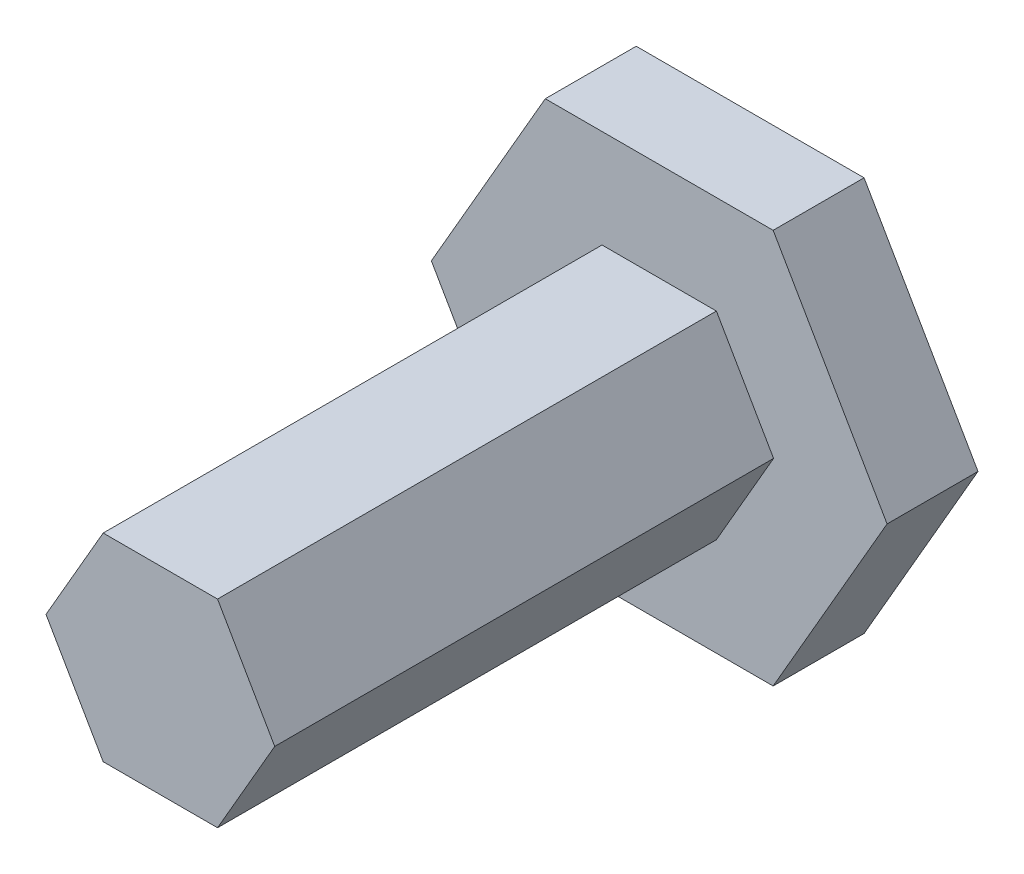
from build123d import *

# Parameters (mm, degrees)
BOSS_EXTRUDE1_DEPTH = 10
BOSS_EXTRUDE2_DEPTH = 2
MOVE_FACE1_BY       = 0.15
MOVE_FACE1_2_BY     = 0.15
MOVE_FACE1_3_BY     = 0.15
MOVE_FACE1_4_BY     = 0.15
MOVE_FACE1_5_BY     = 0.15
MOVE_FACE1_6_BY     = 0.15
MOVE_FACE1_7_BY     = 0.15
MOVE_FACE1_8_BY     = 0.15
MOVE_FACE1_9_BY     = 0.15
MOVE_FACE1_10_BY    = 0.15
MOVE_FACE1_11_BY    = 0.15
MOVE_FACE1_12_BY    = 0.15
MOVE_FACE1_13_BY    = 0.15


with BuildPart() as part:
    # Sketch1 → Boss-Extrude1 (new body)
    with BuildSketch(Plane.XY):
        Polygon((-1.25, -2.165063509), (1.25, -2.165063509), (2.5, 0), (1.25, 2.165063509), (-1.25, 2.165063509), (-2.5, 0), align=None)
    extrude(amount=BOSS_EXTRUDE1_DEPTH)

    # Sketch1<3> → Boss-Extrude2 (add)
    with BuildSketch(Plane.XY):
        Polygon((-2.404700538, -4.165063509), (2.404700538, -4.165063509), (4.809401077, 0), (2.404700538, 4.165063509), (-2.404700538, 4.165063509), (-4.809401077, 0), align=None)
    extrude(amount=-BOSS_EXTRUDE2_DEPTH)

    # Move Face1: a face moved inward by 0.15
    extrude(part.faces().sort_by_distance((0, -3.332050808, 0))[0], amount=MOVE_FACE1_BY, dir=(0, 0, -1), mode=Mode.SUBTRACT)

    # Move Face1 2: a face moved inward by 0.15
    extrude(part.faces().sort_by_distance((0, 4.165063509, -1))[0], amount=MOVE_FACE1_2_BY, dir=(0, -1, 0), mode=Mode.SUBTRACT)

    # Move Face1 3: a face moved inward by 0.15
    extrude(part.faces().sort_by_distance((3.607050808, 2.082531755, -1))[0], amount=MOVE_FACE1_3_BY, dir=(-0.866025404, -0.5, 0), mode=Mode.SUBTRACT)

    # Move Face1 4: a face moved inward by 0.15
    extrude(part.faces().sort_by_distance((3.607050808, -2.082531755, -1))[0], amount=MOVE_FACE1_4_BY, dir=(-0.866025404, 0.5, 0), mode=Mode.SUBTRACT)

    # Move Face1 5: a face moved inward by 0.15
    extrude(part.faces().sort_by_distance((0, -4.165063509, -1))[0], amount=MOVE_FACE1_5_BY, dir=(0, 1, 0), mode=Mode.SUBTRACT)

    # Move Face1 6: a face moved inward by 0.15
    extrude(part.faces().sort_by_distance((-3.607050808, 2.082531755, -1))[0], amount=MOVE_FACE1_6_BY, dir=(0.866025404, -0.5, 0), mode=Mode.SUBTRACT)

    # Move Face1 7: a face moved inward by 0.15
    extrude(part.faces().sort_by_distance((-3.607050808, -2.082531755, -1))[0], amount=MOVE_FACE1_7_BY, dir=(0.866025404, 0.5, 0), mode=Mode.SUBTRACT)

    # Move Face1 8: a face moved inward by 0.15
    extrude(part.faces().sort_by_distance((1.875, 1.082531755, 5))[0], amount=MOVE_FACE1_8_BY, dir=(-0.866025404, -0.5, 0), mode=Mode.SUBTRACT)

    # Move Face1 9: a face moved inward by 0.15
    extrude(part.faces().sort_by_distance((0, 2.165063509, 5))[0], amount=MOVE_FACE1_9_BY, dir=(0, -1, 0), mode=Mode.SUBTRACT)

    # Move Face1 10: a face moved inward by 0.15
    extrude(part.faces().sort_by_distance((-1.875, 1.082531755, 5))[0], amount=MOVE_FACE1_10_BY, dir=(0.866025404, -0.5, 0), mode=Mode.SUBTRACT)

    # Move Face1 11: a face moved inward by 0.15
    extrude(part.faces().sort_by_distance((-1.875, -1.082531755, 5))[0], amount=MOVE_FACE1_11_BY, dir=(0.866025404, 0.5, 0), mode=Mode.SUBTRACT)

    # Move Face1 12: a face moved inward by 0.15
    extrude(part.faces().sort_by_distance((0, -2.165063509, 5))[0], amount=MOVE_FACE1_12_BY, dir=(0, 1, 0), mode=Mode.SUBTRACT)

    # Move Face1 13: a face moved inward by 0.15
    extrude(part.faces().sort_by_distance((1.875, -1.082531755, 5))[0], amount=MOVE_FACE1_13_BY, dir=(-0.866025404, 0.5, 0), mode=Mode.SUBTRACT)


solid = part.part
